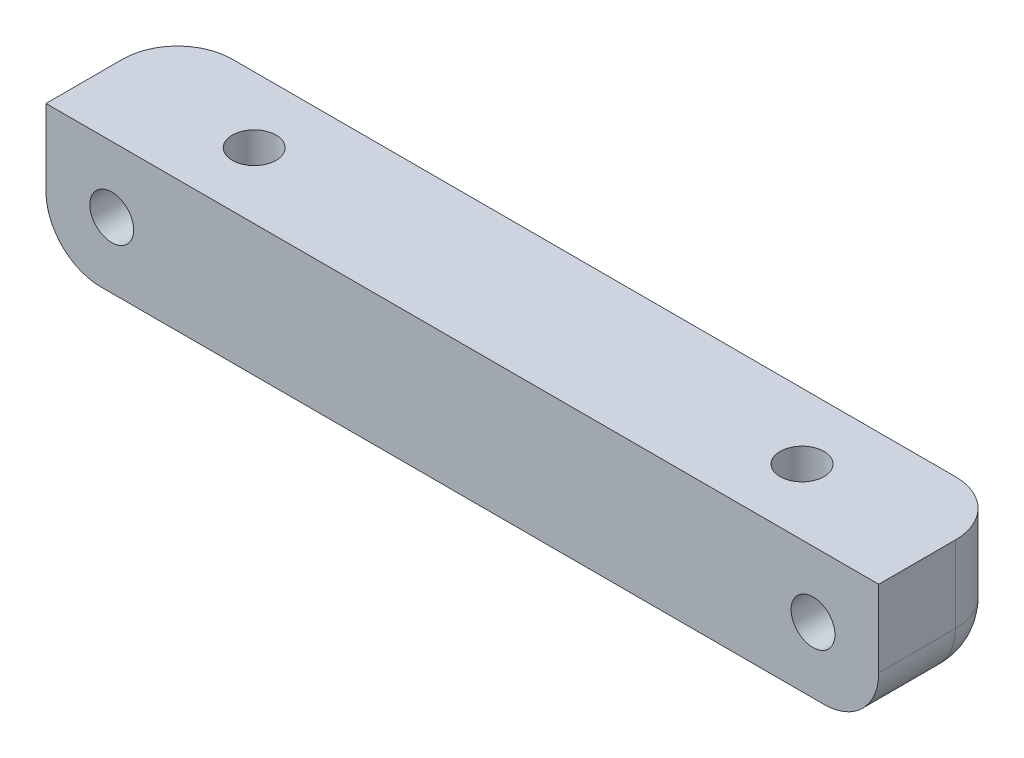
from build123d import *

# Parameters (mm, degrees)
SKETCH1_W           = 76
SKETCH1_H           = 12
BOSS_EXTRUDE1_DEPTH = 6
SKETCH2_R           = 2
CUT_EXTRUDE1_DEPTH  = 8.5
SKETCH3_R           = 2
CUT_EXTRUDE2_DEPTH  = 8.5
FILLET1_R           = 5


with BuildPart() as part:
    # Sketch1 → Boss-Extrude1 (new, symmetric)
    with BuildSketch(Plane.XY):
        Rectangle(SKETCH1_W, SKETCH1_H)
    extrude(amount=BOSS_EXTRUDE1_DEPTH, both=True)

    # Sketch2 → Cut-Extrude1 (cut)
    with BuildSketch(Plane.XY.offset(6)):
        with Locations((-32, 0)):
            Circle(SKETCH2_R)
        with Locations((32, 0)):
            Circle(SKETCH2_R)
    extrude(amount=-CUT_EXTRUDE1_DEPTH, mode=Mode.SUBTRACT)

    # Sketch3 → Cut-Extrude2 (cut)
    with BuildSketch(Plane(origin=(0, 6, 0), x_dir=(1, 0, 0), z_dir=(0, 1, 0))):
        with Locations(Location((-25, 0, 0), (0, 0, 270))):
            Circle(SKETCH3_R)
        with Locations(Location((25, 0, 0), (0, 0, 270))):
            Circle(SKETCH3_R)
    extrude(amount=-CUT_EXTRUDE2_DEPTH, mode=Mode.SUBTRACT)

    # Fillet1
    fillet1_edges = [part.edges().sort_by_distance(p)[0] for p in [
        (38, 0, -6),
        (0, -6, -6),
        (-38, 0, -6),
        (38, -6, 0),
        (-38, -6, 0),
    ]]
    fillet(fillet1_edges, radius=FILLET1_R)


solid = part.part
